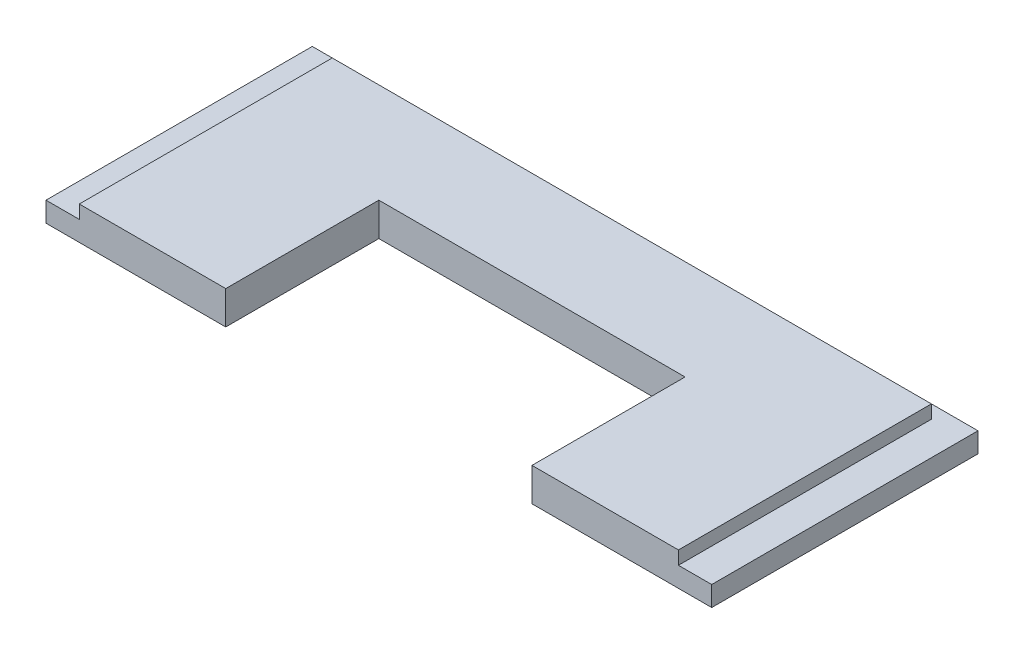
from build123d import *

# Parameters (mm, degrees)
BOSS_EXTRUDE1_DEPTH = 5
SKETCH2_W           = 90
SKETCH2_H           = 2
CUT_EXTRUDE1_DEPTH  = 2


with BuildPart() as part:
    # Sketch1 → Boss-Extrude1 (new body)
    with BuildSketch(Plane(origin=(0, 0, 0), x_dir=(1, 0, 0), z_dir=(0, 1, 0))):
        Polygon((-27, 0), (0, 0), (0, 40), (-100, 40), (-100, 0), (-73, 0), (-73, 23), (-27, 23), align=None)
    extrude(amount=BOSS_EXTRUDE1_DEPTH)

    # Sketch2 → Cut-Extrude1 (cut)
    with BuildSketch(Plane(origin=(0, 5, 0), x_dir=(1, 0, 0), z_dir=(0, 1, 0))):
        Polygon((-100, 40), (-100, 0), (-95, 0), (-95, 38), (-95, 40), align=None)
        with Locations((-50, 39)):
            Rectangle(SKETCH2_W, SKETCH2_H)
        Polygon((-5, 40), (-5, 38), (-5, 0), (0, 0), (0, 40), align=None)
    extrude(amount=-CUT_EXTRUDE1_DEPTH, mode=Mode.SUBTRACT)


solid = part.part
